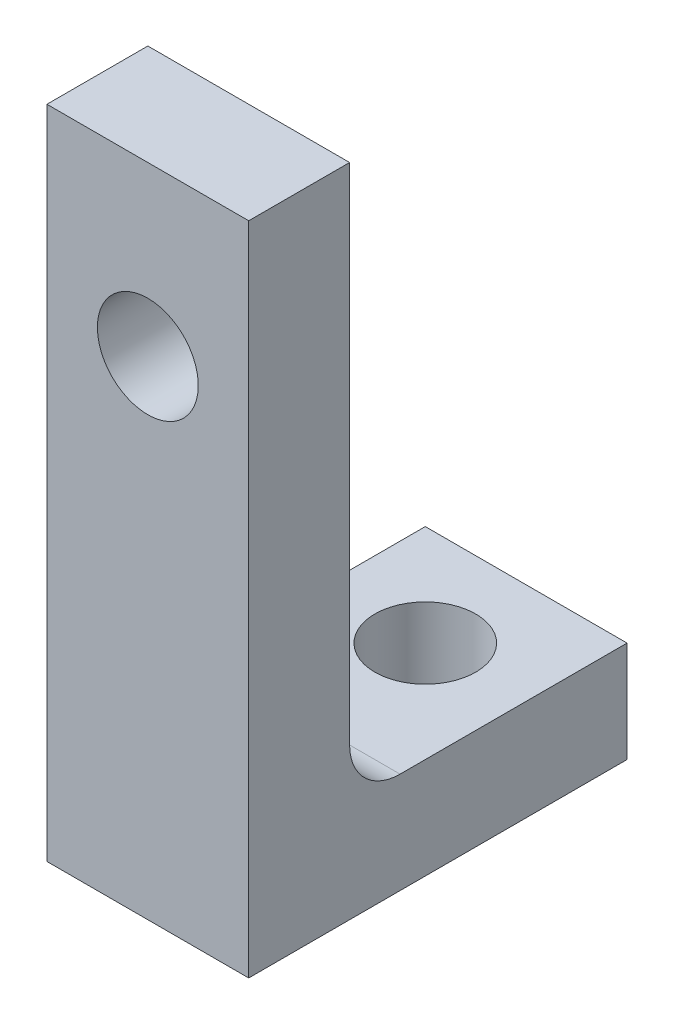
from build123d import *

# Parameters (mm, degrees)
BOSS_EXTRUDE1_DEPTH = 4
SKETCH2_R           = 1
CUT_EXTRUDE1_DEPTH  = 13.932517156
SKETCH3_R           = 1
CUT_EXTRUDE2_DEPTH  = 13.932517156
FILLET1_R           = 1


with BuildPart() as part:
    # Sketch1 → Boss-Extrude1 (new body)
    with BuildSketch(Plane(origin=(0, 0, 0), x_dir=(0, 0, -1), z_dir=(1, 0, 0))):
        Polygon((0, 0), (0, 11), (-2, 11), (-2, -2), (5.5, -2), (5.5, 0), align=None)
    extrude(amount=BOSS_EXTRUDE1_DEPTH)

    # Sketch2 → Cut-Extrude1 (cut, through all)
    with BuildSketch(Plane(origin=(0, 0, 0), x_dir=(-1, 0, 0), z_dir=(0, 0, -1))):
        with Locations(Location((-2, 7.67, 0), (0, 0, 90))):
            Circle(SKETCH2_R)
    extrude(amount=-CUT_EXTRUDE1_DEPTH, mode=Mode.SUBTRACT)

    # Sketch3 → Cut-Extrude2 (cut, through all)
    with BuildSketch(Plane(origin=(0, 0, 0), x_dir=(1, 0, 0), z_dir=(0, 1, 0))):
        with Locations(Location((2, 3.5, 0), (0, 0, 270))):
            Circle(SKETCH3_R)
    extrude(amount=-CUT_EXTRUDE2_DEPTH, mode=Mode.SUBTRACT)

    # Fillet1
    fillet1_edges = [part.edges().sort_by_distance(p)[0] for p in [
        (2, 0, 0),
    ]]
    fillet(fillet1_edges, radius=FILLET1_R)


solid = part.part
